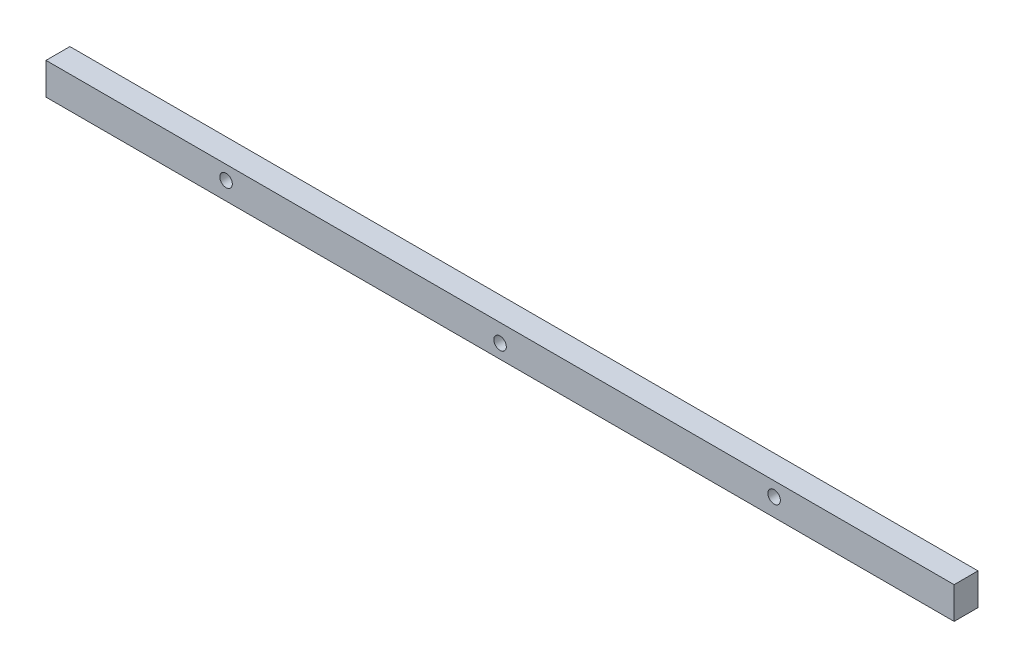
from build123d import *

# Parameters (mm, degrees)
SKETCH1_W           = 361.95
SKETCH1_H           = 12.7
SKETCH1_R           = 2.5
BOSS_EXTRUDE1_DEPTH = 9.525


with BuildPart() as part:
    # Sketch1 → Boss-Extrude1 (new body)
    with BuildSketch(Plane.XY):
        with Locations((180.975, 6.35)):
            Rectangle(SKETCH1_W, SKETCH1_H)
        with Locations(Location((180.975, 5.55625, 0), (0, 0, 180))):
            Circle(SKETCH1_R, mode=Mode.SUBTRACT)
        with Locations(Location((71.755, 7.14375, 0), (0, 0, 180))):
            Circle(SKETCH1_R, mode=Mode.SUBTRACT)
        with Locations(Location((290.195, 7.14375, 0), (0, 0, 180))):
            Circle(SKETCH1_R, mode=Mode.SUBTRACT)
    extrude(amount=BOSS_EXTRUDE1_DEPTH)


solid = part.part
